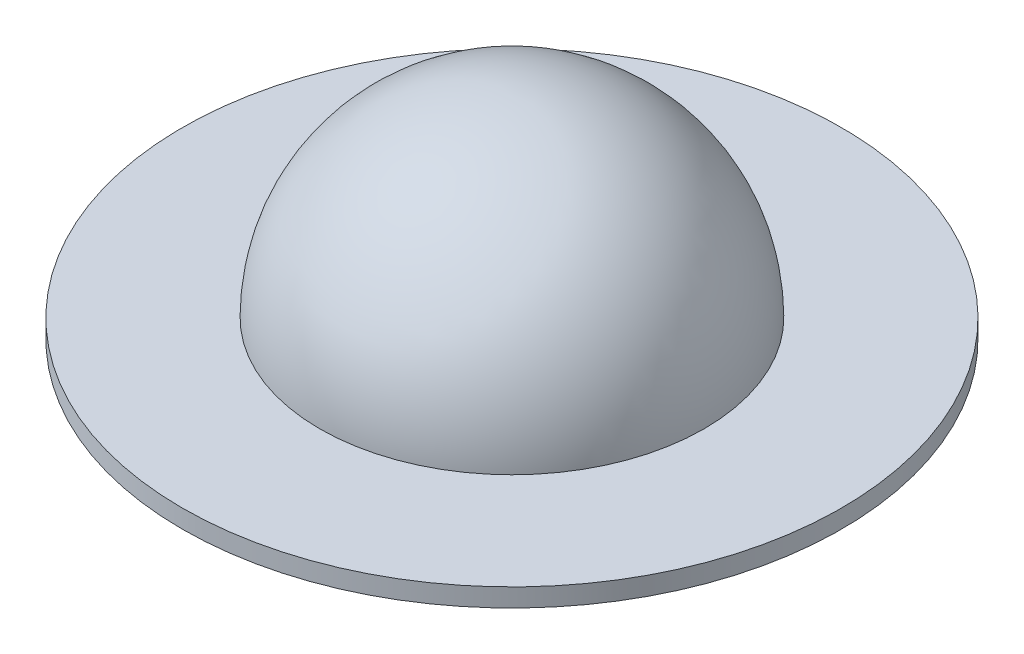
from build123d import *

# Parameters (mm, degrees)
SKETCH1_R           = 72
BOSS_EXTRUDE1_DEPTH = 4


with BuildPart() as part:
    # Sketch1 → Boss-Extrude1 (new body)
    with BuildSketch(Plane(origin=(0, 0, 0), x_dir=(1, 0, 0), z_dir=(0, 1, 0))):
        with Locations(Location((0, 0, 0), (0, 0, 270))):
            Circle(SKETCH1_R)
    extrude(amount=BOSS_EXTRUDE1_DEPTH)

    # Sketch2 → Revolve1 (revolve)
    with BuildSketch(Plane.XY):
        with BuildLine():
            Line((0, 4), (0, 46))
            ThreePointArc((0, 46), (29.69848481, 33.69848481), (42, 4))
            Line((42, 4), (0, 4))
        make_face()
    revolve(axis=Axis((0, 4, 0), (0, 1, 0)))


solid = part.part
